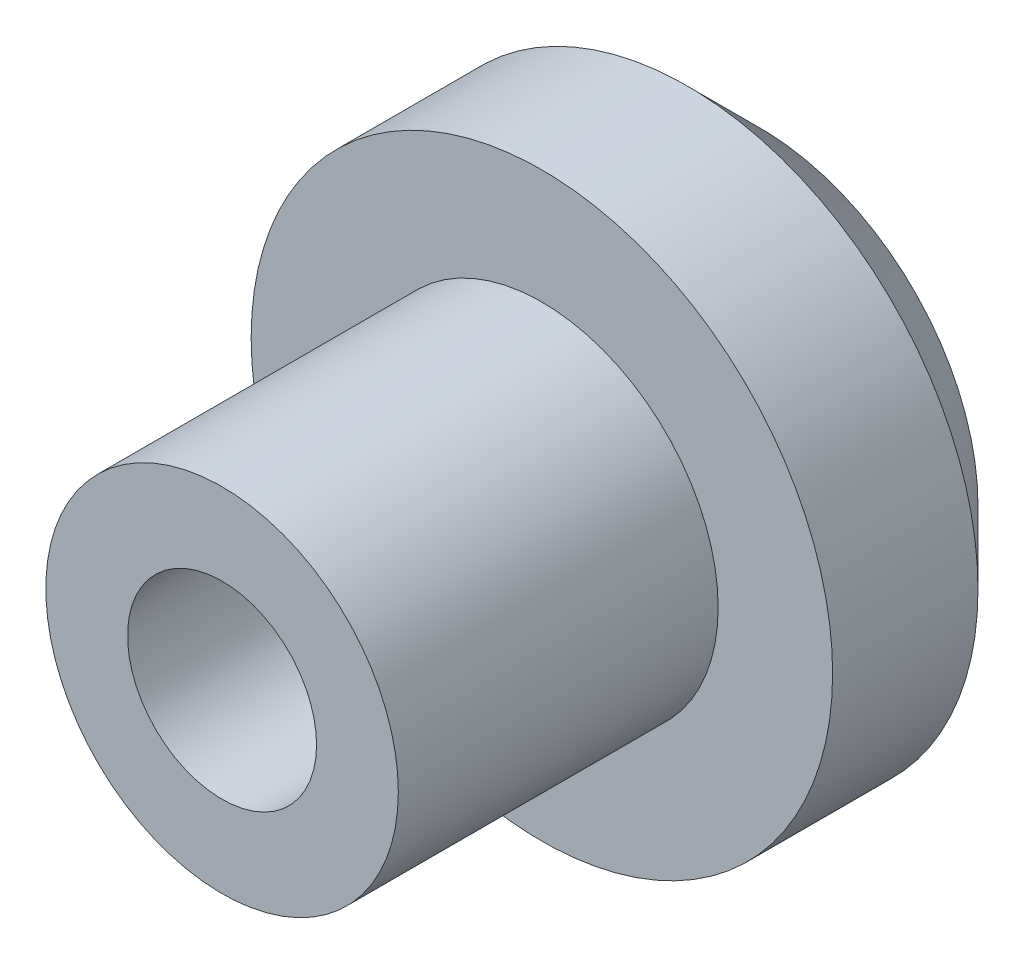
from build123d import *

# Parameters (mm, degrees)
SKETCH1_R           = 4
BOSS_EXTRUDE1_DEPTH = 3
SKETCH2_R           = 2.425
BOSS_EXTRUDE2_DEPTH = 4.4
SKETCH3_R           = 1.3
CUT_EXTRUDE1_DEPTH  = 10.314504818
CHAMFER1_SIZE       = 1


with BuildPart() as part:
    # Sketch1 → Boss-Extrude1 (new body)
    with BuildSketch(Plane.XY):
        Circle(SKETCH1_R)
    extrude(amount=BOSS_EXTRUDE1_DEPTH)

    # Sketch2 → Boss-Extrude2 (add)
    with BuildSketch(Plane.XY.offset(3)):
        Circle(SKETCH2_R)
    extrude(amount=BOSS_EXTRUDE2_DEPTH)

    # Sketch3 → Cut-Extrude1 (cut, through all)
    with BuildSketch(Plane.XY.offset(7.4)):
        Circle(SKETCH3_R)
    extrude(amount=-CUT_EXTRUDE1_DEPTH, mode=Mode.SUBTRACT)

    # Chamfer1
    chamfer1_edges = [part.edges().sort_by_distance(p)[0] for p in [
        (-4, 0, 0),
    ]]
    chamfer(chamfer1_edges, length=CHAMFER1_SIZE)


solid = part.part
